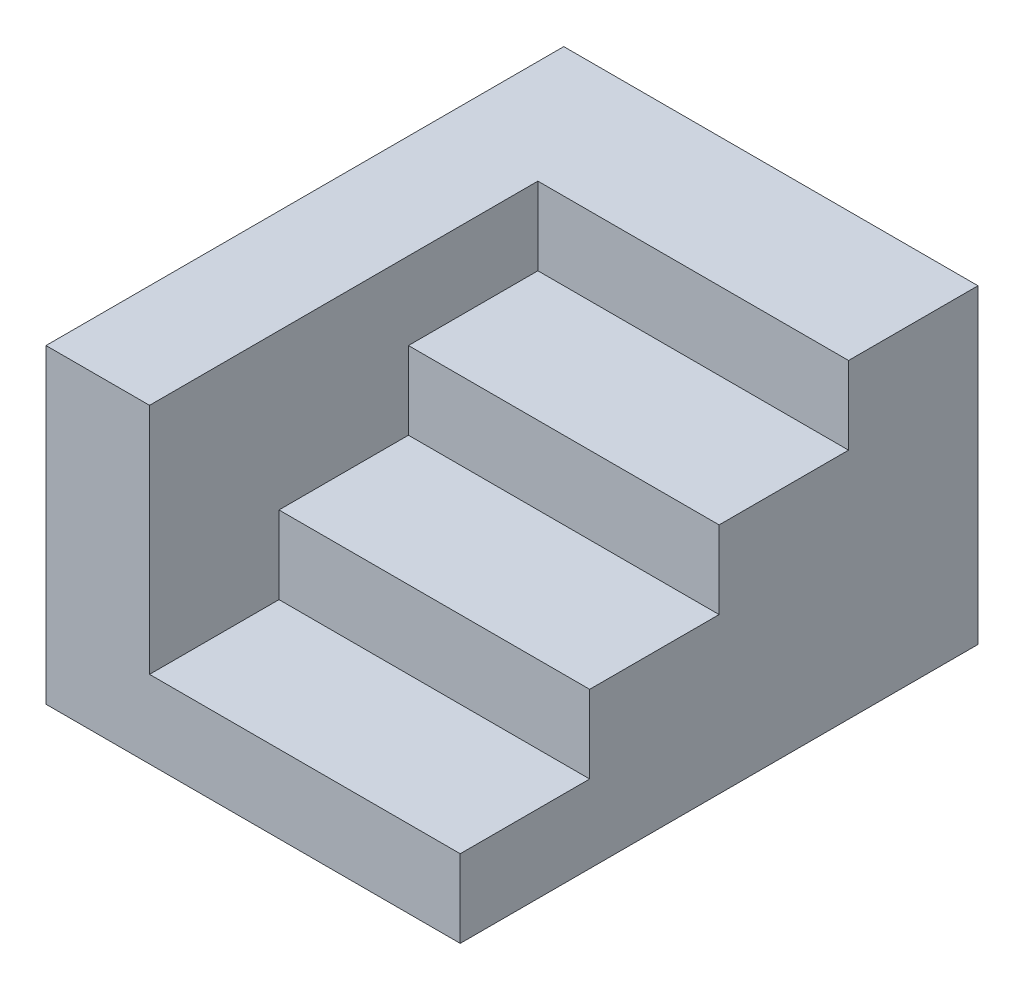
from build123d import *

# Parameters (mm, degrees)
SKETCH1_W           = 100
SKETCH1_H           = 60
BOSS_EXTRUDE1_DEPTH = 20
BOSS_EXTRUDE2_DEPTH = 80


with BuildPart() as part:
    # Sketch1 → Boss-Extrude1 (new body)
    with BuildSketch(Plane(origin=(0, 0, 0), x_dir=(0, 0, -1), z_dir=(1, 0, 0))):
        with Locations((50, 30)):
            Rectangle(SKETCH1_W, SKETCH1_H)
    extrude(amount=BOSS_EXTRUDE1_DEPTH)

    # Sketch1<3> → Boss-Extrude2 (add)
    with BuildSketch(Plane(origin=(0, 0, 0), x_dir=(0, 0, -1), z_dir=(1, 0, 0))):
        Polygon((0, 15), (0, 0), (100, 0), (100, 60), (75, 60), (75, 45), (50, 45), (50, 30), (25, 30), (25, 15), align=None)
    extrude(amount=BOSS_EXTRUDE2_DEPTH)


solid = part.part
